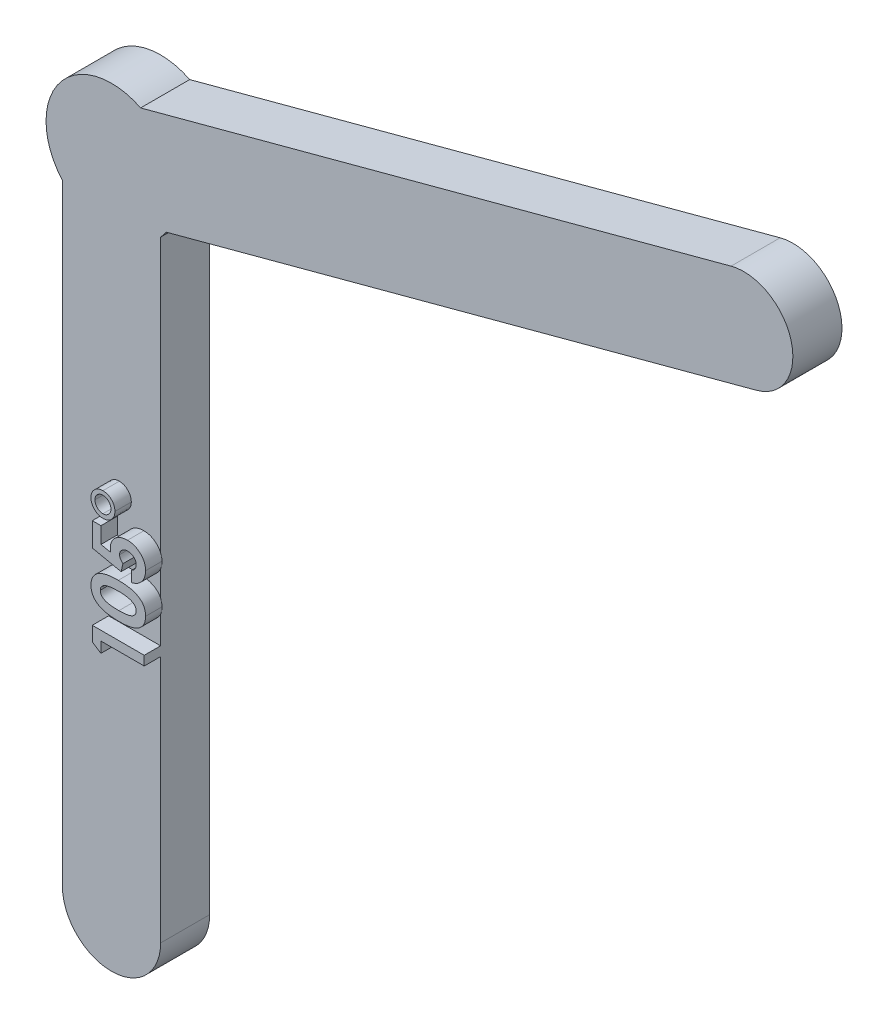
from build123d import *

# Parameters (mm, degrees)
BOSS_EXTRUDE1_DEPTH = 3
BOSS_EXTRUDE2_DEPTH = 1


with BuildPart() as part:
    # Sketch2 → Boss-Extrude1 (new body)
    with BuildSketch(Plane.XY):
        with BuildLine():
            Line((-3, -40), (-3, -2.645751311))
            ThreePointArc((-3, -2.645751311), (-3.173413361, 2.435045716), (1.779142386, 3.582548307))
            Line((1.779142386, 3.582548307), (37.860575916, 13.250539283))
            ThreePointArc((37.860575916, 13.250539283), (41.53481053, 11.129218939), (39.413490187, 7.454984325))
            Line((39.413490187, 7.454984325), (3.332056657, -2.213006651))
            ThreePointArc((3.332056657, -2.213006651), (3.173413361, -2.435045716), (3, -2.645751311))
            Line((3, -2.645751311), (3, -40))
            ThreePointArc((3, -40), (0, -43), (-3, -40))
        make_face()
    extrude(amount=BOSS_EXTRUDE1_DEPTH)

    # Sketch3 → Boss-Extrude2 (add)
    # profile 1 of 4: a face of its own
    with BuildSketch(Plane.XY.offset(3)):
        Polygon((-0.175, -25.154881865), (-0.175, -24.27399745), (3, -24.27399745), (3, -24.843869245), (0.354166667, -24.843869245), (0.354166667, -25.495151297), align=None)
    # profile 2 of 4: a face of its own
    with BuildSketch(Plane.XY.offset(3)):
        with BuildLine():
            add(Edge.make_bspline(
                [(-0.256410256, -22.187223612), (-0.256000846, -22.159639409), (-0.255195836, -22.105401495), (-0.246473924, -22.02552), (-0.233303758, -21.948569182), (-0.214913964, -21.874261296), (-0.19065475, -21.803082912), (-0.161374324, -21.734785029), (-0.126796317, -21.669429262), (-0.086761751, -21.606946387), (-0.040652473, -21.547894496), (0.010185802, -21.491318806), (0.067717809, -21.43948776), (0.130454644, -21.390835172), (0.198771401, -21.345693322), (0.272469109, -21.303770681), (0.352002612, -21.265485151), (0.437488797, -21.230380098), (0.530216664, -21.198990657), (0.631247648, -21.172550921), (0.740605462, -21.149874557), (0.858562124, -21.130734067), (0.985274483, -21.11626696), (1.120658341, -21.106515836), (1.264452704, -21.099824155), (1.363094454, -21.099278026), (1.413772035, -21.09899745)],
                knots=[0, 0, 0, 0, 0.879187688, 1.728717895, 2.558878706, 3.367146394, 4.166631857, 4.95393622, 5.734098362, 6.521634849, 7.316678452, 8.120609651, 8.943639266, 9.781961388, 10.650008082, 11.55217958, 12.483362701, 13.462505087, 14.497127373, 15.602264045, 16.790140859, 18.057036744, 19.411188506, 20.855078804, 22.384284574, 24, 24, 24, 24], degree=3))
            add(Edge.make_bspline(
                [(1.413772035, -21.09899745), (1.465083636, -21.099300727), (1.564781155, -21.099889987), (1.709890925, -21.106237126), (1.846257088, -21.117170742), (1.973869318, -21.131251658), (2.09264741, -21.150576911), (2.202741653, -21.173044562), (2.304172829, -21.200142384), (2.396949232, -21.232384739), (2.482667702, -21.267543829), (2.562361603, -21.305324879), (2.635439661, -21.347366311), (2.704216337, -21.389836589), (2.765684896, -21.437474644), (2.822263901, -21.486752984), (2.87178804, -21.540176006), (2.916848745, -21.595431785), (2.955788395, -21.654560868), (2.989844864, -21.716949245), (3.017468579, -21.783710325), (3.041494248, -21.853626861), (3.058742076, -21.927890678), (3.072427664, -22.005321711), (3.079991159, -22.086794149), (3.080929461, -22.142263866), (3.081410256, -22.170687154)],
                knots=[0, 0, 0, 0, 1.643824397, 3.193921316, 4.652018541, 6.026147715, 7.305813021, 8.506024873, 9.624771103, 10.66654028, 11.650369642, 12.592128821, 13.489360096, 14.35046321, 15.179132238, 15.977837183, 16.751455772, 17.509897991, 18.259653136, 19.016390304, 19.783391144, 20.571659993, 21.382176161, 22.223003704, 23.089447706, 24, 24, 24, 24], degree=3))
            add(Edge.make_bspline(
                [(3.081410256, -22.170687154), (3.080920089, -22.199109624), (3.079959859, -22.254788824), (3.072484978, -22.336482291), (3.058682809, -22.414321079), (3.041375575, -22.489181731), (3.017471846, -22.560488459), (2.989215292, -22.628874266), (2.954465748, -22.692986878), (2.915602853, -22.75414734), (2.870815661, -22.811389711), (2.820807888, -22.865562537), (2.766280514, -22.917423591), (2.705338818, -22.96512523), (2.639096011, -23.009520627), (2.567561271, -23.051080932), (2.490500768, -23.088961965), (2.40793533, -23.12443059), (2.317883816, -23.155810482), (2.21949947, -23.182869572), (2.112045503, -23.205788839), (1.995629446, -23.223802272), (1.870235813, -23.238328502), (1.735965212, -23.249100871), (1.592768059, -23.255486697), (1.494340976, -23.256069291), (1.443664864, -23.256369245)],
                knots=[0, 0, 0, 0, 0.917318694, 1.797013832, 2.644089644, 3.467281984, 4.274391433, 5.068665368, 5.852346333, 6.624865025, 7.405043053, 8.194438745, 9.002823433, 9.831034161, 10.688848002, 11.574933485, 12.499091769, 13.45866927, 14.473616003, 15.574277631, 16.749933499, 18.017757418, 19.374908438, 20.82337846, 22.364486432, 24, 24, 24, 24], degree=3))
            add(Edge.make_bspline(
                [(1.443664864, -23.256369245), (1.373254462, -23.255825542), (1.237396686, -23.25477646), (1.0411217, -23.241481718), (0.859699474, -23.22196841), (0.693433485, -23.193307983), (0.541707931, -23.15786976), (0.405522301, -23.112489271), (0.282992161, -23.060826886), (0.210404568, -23.016803896), (0.175445713, -22.995602018)],
                knots=[0, 0, 0, 0, 1.288568992, 2.486310467, 3.599230591, 4.627010532, 5.572937695, 6.447898582, 7.252493626, 8, 8, 8, 8], degree=3))
            add(Edge.make_bspline(
                [(0.175445713, -22.995602018), (0.141102145, -22.970949484), (0.073953702, -22.922748921), (-0.014199652, -22.838468891), (-0.089592717, -22.747920972), (-0.150519281, -22.649245361), (-0.198565973, -22.544002654), (-0.232500812, -22.431289289), (-0.252272829, -22.311521498), (-0.255010519, -22.229274958), (-0.256410256, -22.187223612)],
                knots=[0, 0, 0, 0, 1.058512271, 2.069600068, 3.047294572, 4.004278952, 4.967380941, 5.939006123, 6.946246673, 8, 8, 8, 8], degree=3))
        make_face()
        with BuildLine():
            add(Edge.make_bspline(
                [(0.313461538, -22.173231224), (0.314647089, -22.198164977), (0.316971398, -22.247048368), (0.336589396, -22.318024416), (0.367119772, -22.384663133), (0.402937146, -22.435915702), (0.437997174, -22.473843075), (0.469692245, -22.50046678), (0.505088209, -22.526130336), (0.5457633, -22.548770627), (0.590374583, -22.570366594), (0.639050565, -22.590819426), (0.692584041, -22.608406161), (0.750614615, -22.625179465), (0.814547313, -22.639686238), (0.884999784, -22.65237958), (0.962212565, -22.663193069), (1.046509296, -22.670991953), (1.137448259, -22.678152731), (1.235421604, -22.683308732), (1.340408748, -22.685459568), (1.412711585, -22.686144155), (1.45002504, -22.68649745)],
                knots=[0, 0, 0, 0, 1.076486532, 2.110485037, 3.16053299, 4.233735637, 4.798028448, 5.389657808, 6.0205397, 6.6857231, 7.399126456, 8.163539924, 8.966557062, 9.834164971, 10.774831688, 11.799768806, 12.928987201, 14.14492726, 15.459726247, 16.873396567, 18.386448164, 20, 20, 20, 20], degree=3))
            add(Edge.make_bspline(
                [(1.45002504, -22.68649745), (1.498366186, -22.685914523), (1.591063917, -22.684796717), (1.72437073, -22.678981137), (1.845884837, -22.667186388), (1.956076433, -22.652860272), (2.054303096, -22.632171296), (2.141437387, -22.608758289), (2.216697621, -22.579702468), (2.280987028, -22.546139154), (2.335677326, -22.508962718), (2.382164459, -22.468606882), (2.42242009, -22.42644467), (2.455119251, -22.381160293), (2.480178379, -22.33286173), (2.498203101, -22.281952199), (2.509236783, -22.228399345), (2.5107668, -22.191726903), (2.511538462, -22.173231224)],
                knots=[0, 0, 0, 0, 1.771738815, 3.39744054, 4.888007323, 6.245018868, 7.467093912, 8.564230264, 9.548241846, 10.417081984, 11.216594933, 11.965786359, 12.669352538, 13.348558586, 14.005353126, 14.656563323, 15.322440191, 16, 16, 16, 16], degree=3))
            add(Edge.make_bspline(
                [(2.511538462, -22.173231224), (2.511010434, -22.155370259), (2.50997662, -22.120400709), (2.499364668, -22.069407274), (2.482111937, -22.021184258), (2.457706739, -21.975877263), (2.426671795, -21.93332423), (2.388870725, -21.893733133), (2.34392674, -21.85740256), (2.310571656, -21.836236203), (2.293384415, -21.825329582)],
                knots=[0, 0, 0, 0, 0.992283464, 1.942767638, 2.88273346, 3.832339453, 4.79467288, 5.803907806, 6.868395428, 8, 8, 8, 8], degree=3))
            add(Edge.make_bspline(
                [(2.293384415, -21.825329582), (2.2698986, -21.812488872), (2.22065075, -21.785562945), (2.137546839, -21.754404216), (2.043819364, -21.728176534), (1.939176634, -21.705602752), (1.823205926, -21.690163662), (1.69664262, -21.676867537), (1.558849395, -21.670454485), (1.463385752, -21.669411367), (1.413772035, -21.668869245)],
                knots=[0, 0, 0, 0, 0.710965849, 1.490837728, 2.352621235, 3.297892224, 4.334225155, 5.461620853, 6.680770821, 8, 8, 8, 8], degree=3))
            add(Edge.make_bspline(
                [(1.413772035, -21.668869245), (1.363727648, -21.669078655), (1.267400744, -21.669481734), (1.129112143, -21.676877059), (1.002808457, -21.687175614), (0.88877167, -21.702239428), (0.786724952, -21.721621762), (0.696674974, -21.745510562), (0.618444263, -21.77367368), (0.552110828, -21.807071781), (0.495736507, -21.844062254), (0.447371712, -21.883328769), (0.406079071, -21.925037363), (0.371703192, -21.969118285), (0.345437441, -22.016591802), (0.326891649, -22.06655111), (0.315672066, -22.119098628), (0.314208327, -22.154943475), (0.313461538, -22.173231224)],
                knots=[0, 0, 0, 0, 1.793836731, 3.452829483, 4.963243077, 6.335886805, 7.574563692, 8.684454726, 9.672768357, 10.54971625, 11.340229787, 12.085688095, 12.778991901, 13.440269426, 14.083255152, 14.715733572, 15.344777694, 16, 16, 16, 16], degree=3))
        make_face(mode=Mode.SUBTRACT)
    # profile 3 of 4: a face of its own
    with BuildSketch(Plane.XY.offset(3)):
        with BuildLine():
            Line((-0.175, -20.183768083), (-0.175, -18.738100015))
            Line((-0.175, -18.738100015), (0.354166667, -18.738100015))
            Line((0.354166667, -18.738100015), (0.354166667, -19.732195567))
            Line((0.354166667, -19.732195567), (0.954567308, -19.856219005))
            add(Edge.make_bspline(
                [(0.954567308, -19.856219005), (0.949860453, -19.839319036), (0.940577569, -19.805988826), (0.93126801, -19.755776822), (0.92523385, -19.707114393), (0.924428974, -19.675182404), (0.924038462, -19.659689558)],
                knots=[0, 0, 0, 0, 1.05461699, 2.079921384, 3.068411212, 4, 4, 4, 4], degree=3))
            add(Edge.make_bspline(
                [(0.924038462, -19.659689558), (0.924812065, -19.625929023), (0.926337007, -19.559379571), (0.940813682, -19.462026168), (0.963614006, -19.368804534), (0.996131972, -19.279999936), (1.038454945, -19.195699126), (1.089653878, -19.115799914), (1.149818696, -19.040204237), (1.218987066, -18.970254992), (1.294935502, -18.905982705), (1.377081772, -18.850101616), (1.46425455, -18.80237568), (1.5569957, -18.76441612), (1.654722746, -18.734455199), (1.757498313, -18.712804768), (1.865444205, -18.700001787), (1.93908797, -18.698275384), (1.976647636, -18.697394886)],
                knots=[0, 0, 0, 0, 1.01440847, 1.999622559, 2.951875003, 3.895578053, 4.836219714, 5.782137149, 6.743708247, 7.735272588, 8.734977101, 9.730283169, 10.717124674, 11.717316708, 12.737475749, 13.78628267, 14.87096371, 16, 16, 16, 16], degree=3))
            add(Edge.make_bspline(
                [(1.976647636, -18.697394886), (2.014633256, -18.698471741), (2.089589988, -18.700596691), (2.199810405, -18.714436265), (2.305347887, -18.738931282), (2.406436844, -18.772286927), (2.502206798, -18.817114441), (2.594432718, -18.86950591), (2.681133664, -18.933261188), (2.762568124, -19.005297728), (2.837049691, -19.083929276), (2.902401087, -19.167859406), (2.958366099, -19.255679557), (3.002753164, -19.348632215), (3.038048148, -19.445295819), (3.063686875, -19.546005909), (3.078401729, -19.651196908), (3.080396394, -19.722609968), (3.081410256, -19.758908308)],
                knots=[0, 0, 0, 0, 1.068214675, 2.107899807, 3.117335077, 4.110871058, 5.095206435, 6.086091645, 7.088956472, 8.115291905, 9.140102477, 10.129911027, 11.102477109, 12.062389472, 13.02046727, 13.992137592, 14.979429371, 16, 16, 16, 16], degree=3))
            add(Edge.make_bspline(
                [(3.081410256, -19.758908308), (3.080553487, -19.79136238), (3.078863759, -19.855368603), (3.069191791, -19.949797139), (3.049983355, -20.040361332), (3.025867721, -20.127954099), (2.992625683, -20.211364404), (2.954425098, -20.292311041), (2.90646499, -20.368357239), (2.853629949, -20.441663431), (2.793625688, -20.50941149), (2.728785352, -20.572313591), (2.657896897, -20.627976986), (2.582338125, -20.678475495), (2.500698196, -20.721065381), (2.414445642, -20.75913827), (2.322609586, -20.790241595), (2.258952506, -20.806035325), (2.226602564, -20.814061553)],
                knots=[0, 0, 0, 0, 1.055144606, 2.080965977, 3.079696235, 4.061281178, 5.030010203, 5.994686618, 6.966205752, 7.947572972, 8.929036963, 9.903776773, 10.879904045, 11.854643856, 12.853445432, 13.868704235, 14.916895142, 16, 16, 16, 16], degree=3))
            Line((2.226602564, -20.814061553), (2.226602564, -20.162779502))
            add(Edge.make_bspline(
                [(2.226602564, -20.162779502), (2.2490257, -20.150877837), (2.292602504, -20.127748308), (2.350368396, -20.083684636), (2.399871513, -20.034694032), (2.440196073, -19.979977241), (2.472150078, -19.921350826), (2.495375872, -19.859110815), (2.509002642, -19.793633158), (2.510687604, -19.749006554), (2.511538462, -19.726471409)],
                knots=[0, 0, 0, 0, 1.10506944, 2.147576346, 3.153981456, 4.13180336, 5.099527609, 6.055753385, 7.01821161, 8, 8, 8, 8], degree=3))
            add(Edge.make_bspline(
                [(2.511538462, -19.726471409), (2.510947576, -19.710766669), (2.509785, -19.679867328), (2.50363468, -19.634342036), (2.491986113, -19.590886145), (2.475855555, -19.54917657), (2.455738928, -19.509101269), (2.430342997, -19.471234736), (2.401111339, -19.434918161), (2.367567912, -19.400704428), (2.330174793, -19.369716649), (2.289993338, -19.342543756), (2.247916387, -19.318247442), (2.202277167, -19.300250791), (2.154438481, -19.285513055), (2.104039466, -19.274659591), (2.051021262, -19.268173422), (2.01482722, -19.267572976), (1.996364183, -19.267266681)],
                knots=[0, 0, 0, 0, 0.978869489, 1.925942215, 2.855067702, 3.774946051, 4.70828698, 5.642468714, 6.60995405, 7.609372294, 8.622401667, 9.629904756, 10.629323, 11.642352373, 12.678539694, 13.745912462, 14.850161547, 16, 16, 16, 16], degree=3))
            add(Edge.make_bspline(
                [(1.996364183, -19.267266681), (1.978329715, -19.267622172), (1.943225185, -19.268314143), (1.891679164, -19.274038269), (1.842771306, -19.284278613), (1.796127073, -19.298231195), (1.752029496, -19.316092075), (1.71021687, -19.337919589), (1.670897628, -19.363805519), (1.634883088, -19.393894299), (1.601818883, -19.425964762), (1.573009836, -19.46047579), (1.548770358, -19.496776329), (1.528965852, -19.534799214), (1.512557035, -19.574195974), (1.502358941, -19.61585546), (1.494574966, -19.658764191), (1.494134135, -19.688060493), (1.493910256, -19.702938756)],
                knots=[0, 0, 0, 0, 1.166353127, 2.270334681, 3.348811111, 4.394351869, 5.415506664, 6.421447184, 7.440758738, 8.453871, 9.452682422, 10.416618495, 11.356052082, 12.270018172, 13.186757755, 14.10810127, 15.039190426, 16, 16, 16, 16], degree=3))
            add(Edge.make_bspline(
                [(1.493910256, -19.702938756), (1.49450671, -19.719102911), (1.49570213, -19.751499345), (1.505940133, -19.799465256), (1.521093441, -19.847275752), (1.543719924, -19.894308853), (1.572750982, -19.941006888), (1.607825567, -19.98745024), (1.6495043, -20.033451041), (1.680674523, -20.062516595), (1.69679988, -20.07755314)],
                knots=[0, 0, 0, 0, 0.882519632, 1.768758668, 2.670168731, 3.618680561, 4.612333577, 5.671392632, 6.795336641, 8, 8, 8, 8], degree=3))
            Line((1.69679988, -20.07755314), (1.58676883, -20.557110431))
            Line((1.58676883, -20.557110431), (-0.175, -20.183768083))
        make_face()
    # profile 4 of 4: a face of its own
    with BuildSketch(Plane.XY.offset(3)):
        with BuildLine():
            add(Edge.make_bspline(
                [(0.476282051, -16.824958989), (0.501543872, -16.825505484), (0.55122174, -16.826580176), (0.624352745, -16.837013476), (0.694208258, -16.854492691), (0.761803607, -16.876903338), (0.825395964, -16.908042089), (0.886396731, -16.944903837), (0.943669883, -16.989402672), (0.9978957, -17.039014969), (1.047295391, -17.093515132), (1.090947065, -17.151405488), (1.127096601, -17.212864468), (1.157366856, -17.276577248), (1.180332148, -17.343408663), (1.196689885, -17.412864586), (1.20741609, -17.485236986), (1.208449037, -17.534503871), (1.208974359, -17.559559349)],
                knots=[0, 0, 0, 0, 1.048753193, 2.062393874, 3.059725798, 4.03711221, 5.013824111, 5.993903926, 6.992478922, 8.020738441, 9.043061753, 10.043343452, 11.026424807, 11.999358773, 12.968420071, 13.955122655, 14.960044262, 16, 16, 16, 16], degree=3))
            add(Edge.make_bspline(
                [(1.208974359, -17.559559349), (1.208454225, -17.584616682), (1.207431478, -17.633887214), (1.196631189, -17.706233128), (1.180530583, -17.775855144), (1.156529218, -17.842391691), (1.126678292, -17.90615653), (1.090260147, -17.967072817), (1.046482503, -18.024600993), (0.996781055, -18.078582797), (0.942375086, -18.128107638), (0.88420218, -18.171482912), (0.823225465, -18.208946116), (0.758107997, -18.237837437), (0.69067286, -18.261947038), (0.619758864, -18.27798784), (0.545943315, -18.288833106), (0.495615647, -18.289833085), (0.469921875, -18.290343604)],
                knots=[0, 0, 0, 0, 1.037227242, 2.039512271, 3.023626077, 3.993053151, 4.963434463, 5.936395473, 6.927031705, 7.952593414, 8.972234493, 9.969891786, 10.954906455, 11.929570282, 12.915563215, 13.916770353, 14.936449251, 16, 16, 16, 16], degree=3))
            add(Edge.make_bspline(
                [(0.469921875, -18.290343604), (0.445290866, -18.289811451), (0.396869022, -18.288765297), (0.325492116, -18.278103661), (0.256787066, -18.261182775), (0.190979117, -18.23681523), (0.128167681, -18.205730248), (0.067236284, -18.169180135), (0.010175979, -18.123937412), (-0.044275745, -18.073515722), (-0.093962638, -18.018218509), (-0.137555056, -17.95952238), (-0.173973759, -17.89802202), (-0.203993097, -17.834134423), (-0.227847104, -17.767768562), (-0.244158222, -17.698411219), (-0.254789074, -17.626671533), (-0.255866772, -17.577830012), (-0.256410256, -17.553199173)],
                knots=[0, 0, 0, 0, 1.027628768, 2.020204677, 3.0054932, 3.977172113, 4.942988595, 5.928118098, 6.937247537, 7.976812879, 9.023474825, 10.036014018, 11.024160528, 12.002107364, 12.979092523, 13.962271943, 14.972371232, 16, 16, 16, 16], degree=3))
            add(Edge.make_bspline(
                [(-0.256410256, -17.553199173), (-0.255881051, -17.528566172), (-0.254836181, -17.479930408), (-0.244068832, -17.408427146), (-0.227959354, -17.339440503), (-0.203981879, -17.27352423), (-0.173948227, -17.210285117), (-0.137706982, -17.149501332), (-0.093944483, -17.091941849), (-0.043999627, -17.038019265), (0.009956511, -16.987787182), (0.068273488, -16.944627592), (0.128824771, -16.907104674), (0.192846684, -16.877455064), (0.259342082, -16.853394895), (0.329176204, -16.837233977), (0.401748506, -16.826543556), (0.451226198, -16.825491671), (0.476282051, -16.824958989)],
                knots=[0, 0, 0, 0, 1.02774298, 2.029191086, 3.012479778, 3.981238486, 4.951290381, 5.931946007, 6.930416638, 7.964088953, 8.997761269, 10.003308488, 10.98854748, 11.966603007, 12.943696749, 13.935593372, 14.954569896, 16, 16, 16, 16], degree=3))
        make_face()
        with BuildLine():
            add(Edge.make_bspline(
                [(0.479462139, -17.069189758), (0.462471258, -17.069424264), (0.428972226, -17.069886612), (0.379883793, -17.077505977), (0.332524379, -17.088023775), (0.287283463, -17.10328392), (0.24427911, -17.123234284), (0.203398935, -17.147571829), (0.164484674, -17.176174899), (0.128492582, -17.209237523), (0.095853701, -17.245103846), (0.066652511, -17.282897251), (0.042455186, -17.323086522), (0.023016589, -17.365273093), (0.006315159, -17.408801858), (-0.003707976, -17.454711924), (-0.01154919, -17.502263298), (-0.011966436, -17.534718897), (-0.012179487, -17.55129112)],
                knots=[0, 0, 0, 0, 1.061159961, 2.092171217, 3.098605391, 4.092036902, 5.070589041, 6.057187883, 7.061962211, 8.084674938, 9.107387665, 10.090954379, 11.06617917, 12.032717429, 12.99305519, 13.973669989, 14.965331307, 16, 16, 16, 16], degree=3))
            add(Edge.make_bspline(
                [(-0.012179487, -17.55129112), (-0.01157068, -17.568051412), (-0.01036426, -17.601263796), (-0.004409395, -17.650200831), (0.007572839, -17.69685371), (0.022606002, -17.742054962), (0.043122897, -17.784898142), (0.067542797, -17.826391236), (0.096744971, -17.865435361), (0.129769422, -17.902214665), (0.165718261, -17.935960463), (0.204573602, -17.964950546), (0.244977971, -17.990352408), (0.287582445, -18.010455361), (0.331832846, -18.026567734), (0.377821945, -18.038209426), (0.425871214, -18.044356322), (0.458458137, -18.045521173), (0.475010016, -18.046112835)],
                knots=[0, 0, 0, 0, 1.042034071, 2.064906527, 3.055369705, 4.030203466, 5.020228521, 6.000742353, 7.017744738, 8.043920206, 9.069249762, 10.075703201, 11.051782302, 12.029903876, 12.99669358, 13.974371501, 14.971122288, 16, 16, 16, 16], degree=3))
            add(Edge.make_bspline(
                [(0.475010016, -18.046112835), (0.491349767, -18.045520146), (0.523514051, -18.044353455), (0.570936909, -18.038223162), (0.616468237, -18.026465839), (0.660506807, -18.010425399), (0.703332854, -17.990458383), (0.743356347, -17.964229259), (0.782721478, -17.935019181), (0.819574977, -17.900938323), (0.853594861, -17.864058718), (0.883277913, -17.824563201), (0.908722399, -17.783622403), (0.929101491, -17.740636346), (0.945194342, -17.696373754), (0.956841315, -17.650387952), (0.962986781, -17.60233779), (0.964151827, -17.56975099), (0.96474359, -17.553199173)],
                knots=[0, 0, 0, 0, 1.017878107, 2.003660885, 2.970612419, 3.939454555, 4.919652619, 5.904816436, 6.913406512, 7.969270601, 9.02513469, 10.033724766, 11.041277553, 12.021475617, 12.990317753, 13.970071221, 14.968938047, 16, 16, 16, 16], degree=3))
            add(Edge.make_bspline(
                [(0.96474359, -17.553199173), (0.964515736, -17.536840687), (0.964066668, -17.504600367), (0.956359019, -17.457448889), (0.946146284, -17.411789288), (0.929505189, -17.368485652), (0.910263551, -17.326033898), (0.884925795, -17.286252494), (0.856415485, -17.247396305), (0.822504018, -17.212069657), (0.787116244, -17.177952839), (0.747777121, -17.149765554), (0.707718654, -17.124520148), (0.665616684, -17.10387006), (0.621397497, -17.089062601), (0.575848465, -17.07693948), (0.528165265, -17.071009446), (0.49579822, -17.069800121), (0.479462139, -17.069189758)],
                knots=[0, 0, 0, 0, 1.029744634, 2.029484694, 3.00508751, 3.97324883, 4.947661161, 5.937798898, 6.940036528, 7.980134083, 9.020231638, 10.033191535, 11.023329272, 12.003497406, 12.979740652, 13.958541426, 14.969648588, 16, 16, 16, 16], degree=3))
        make_face(mode=Mode.SUBTRACT)
    extrude(amount=BOSS_EXTRUDE2_DEPTH)


solid = part.part
